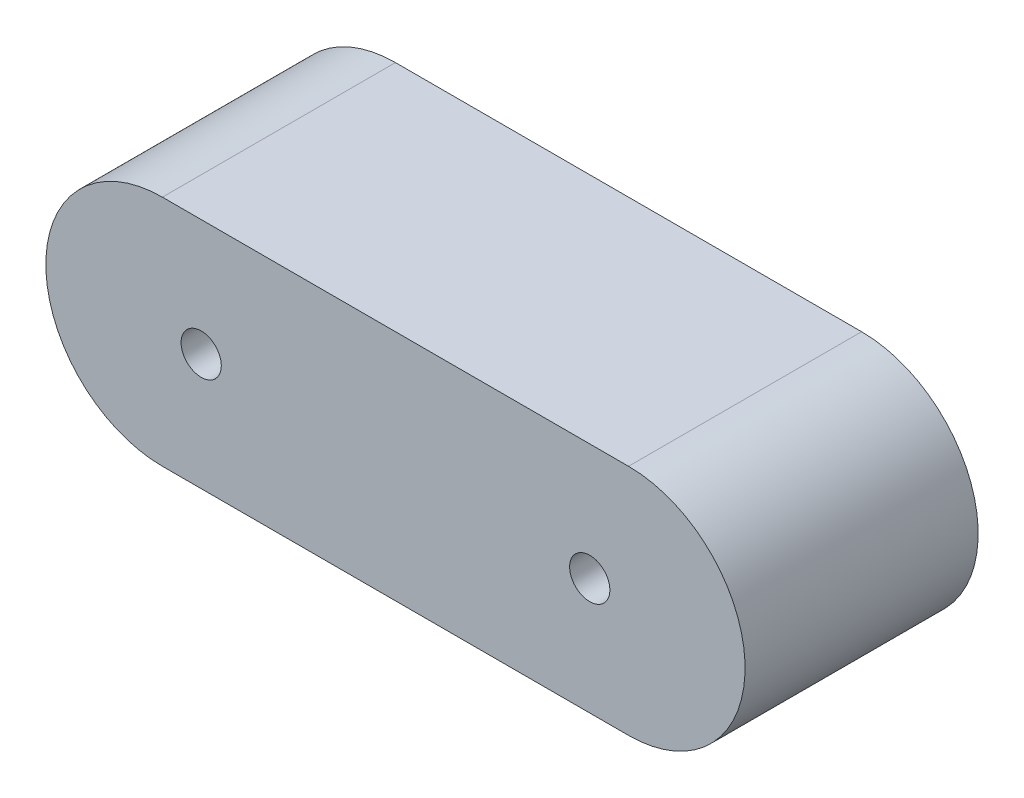
from build123d import *

# Parameters (mm, degrees)
EXTRUDE_2_DEPTH     = 20
SKETCH_3_R          = 1.725801952
CUT_EXTRUDE_1_DEPTH = 8


with BuildPart() as part:
    # 草图2 → 凸台-拉伸2 (new body)
    with BuildSketch(Plane.XY):
        with BuildLine():
            Line((-20, 10), (20, 10))
            ThreePointArc((20, 10), (30, 0), (20, -10))
            Line((20, -10), (-20, -10))
            ThreePointArc((-20, -10), (-30, 0), (-20, 10))
        make_face()
    extrude(amount=EXTRUDE_2_DEPTH)

    # 草图3 → 切除-拉伸1 (cut)
    with BuildSketch(Plane.XY.offset(20)):
        with Locations((-16.67047348, 0)):
            Circle(SKETCH_3_R)
        with Locations((16.67047348, 0)):
            Circle(SKETCH_3_R)
    extrude(amount=-CUT_EXTRUDE_1_DEPTH, mode=Mode.SUBTRACT)


solid = part.part
